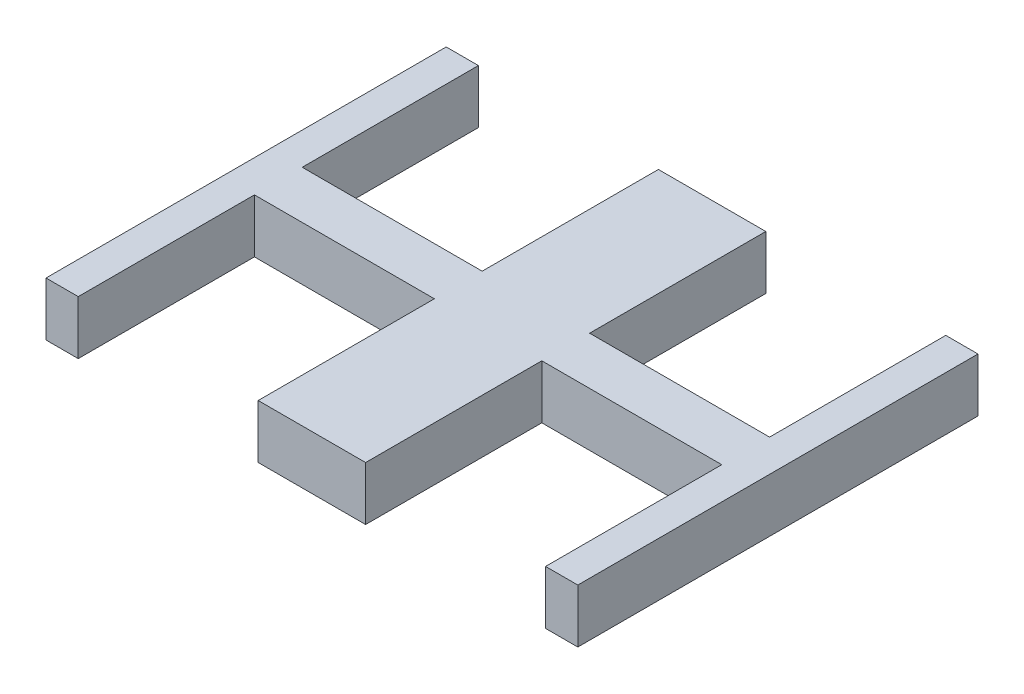
from build123d import *

# Parameters (mm, degrees)
SKETCH1_W           = 19.8
SKETCH1_H           = 14.9
BOSS_EXTRUDE1_DEPTH = 2
SKETCH2_W           = 6.7
SKETCH2_H           = 6.56
CUT_EXTRUDE2_DEPTH  = 13.5503984


with BuildPart() as part:
    # Sketch1 → Boss-Extrude1 (new body)
    with BuildSketch(Plane(origin=(0, 0, 0), x_dir=(1, 0, 0), z_dir=(0, 1, 0))):
        Rectangle(SKETCH1_W, SKETCH1_H)
    extrude(amount=BOSS_EXTRUDE1_DEPTH)

    # Sketch2 → Cut-Extrude2 (cut, through all)
    with BuildSketch(Plane(origin=(0, 2, 0), x_dir=(1, 0, 0), z_dir=(0, 1, 0))):
        with Locations((-5.35, 4.17)):
            Rectangle(SKETCH2_W, SKETCH2_H)
        with Locations((5.35, -4.17)):
            Rectangle(SKETCH2_W, SKETCH2_H)
        with Locations((-5.35, -4.17)):
            Rectangle(SKETCH2_W, SKETCH2_H)
        with Locations((5.35, 4.17)):
            Rectangle(SKETCH2_W, SKETCH2_H)
    extrude(amount=-CUT_EXTRUDE2_DEPTH, mode=Mode.SUBTRACT)


solid = part.part
